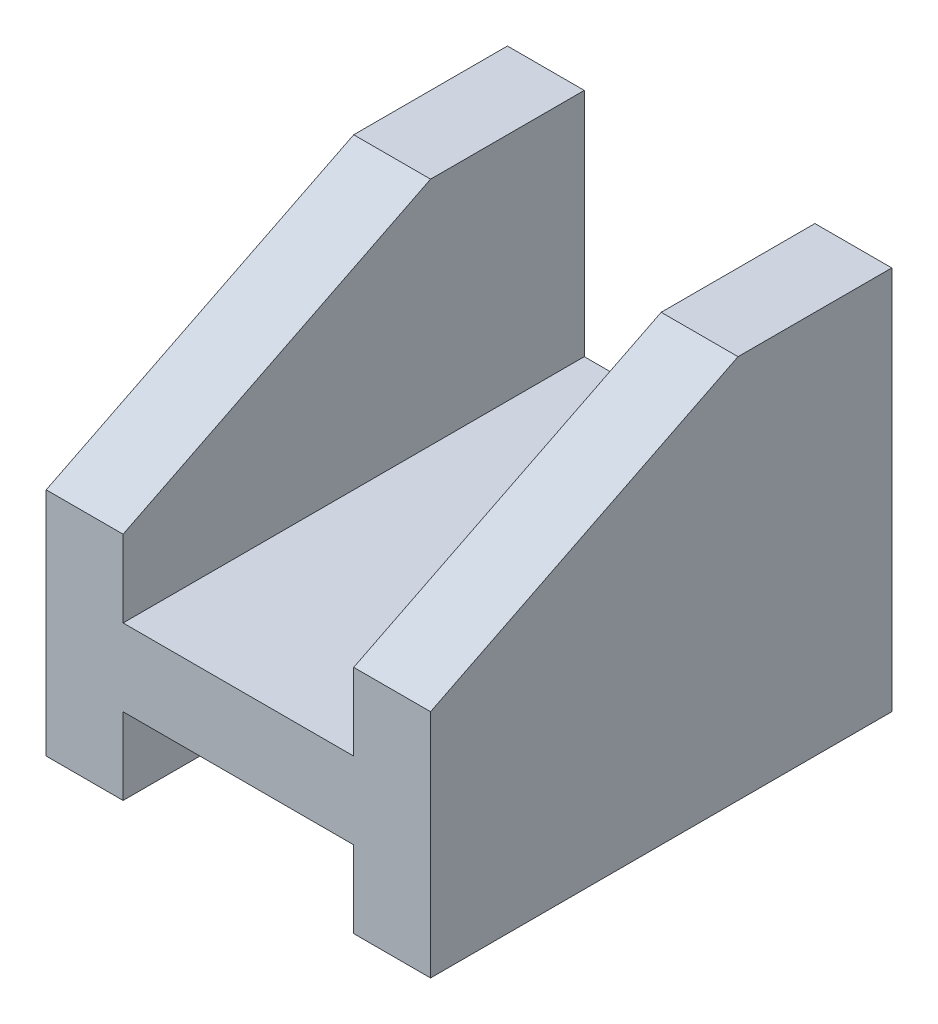
from build123d import *

# Parameters (mm, degrees)
BOSS_EXTRUDE1_DEPTH = 38.1
CUT_EXTRUDE1_DEPTH  = 55.194972092


with BuildPart() as part:
    # Sketch1 → Boss-Extrude1 (new body)
    with BuildSketch(Plane.XY):
        Polygon((9.525, 2.8), (-9.525, 2.8), (-9.525, 21.85), (-15.875, 21.85), (-15.875, -9.9), (-9.525, -9.9), (-9.525, -3.55), (9.525, -3.55), (9.525, -9.9), (15.875, -9.9), (15.875, 21.85), (9.525, 21.85), align=None)
    extrude(amount=BOSS_EXTRUDE1_DEPTH)

    # Sketch2 → Cut-Extrude1 (cut, through all)
    with BuildSketch(Plane(origin=(15.875, 0, 0), x_dir=(0, 0, -1), z_dir=(1, 0, 0))):
        Polygon((-38.1, 9.15), (-12.7, 21.85), (-38.1, 21.85), align=None)
    extrude(amount=-CUT_EXTRUDE1_DEPTH, mode=Mode.SUBTRACT)


solid = part.part
